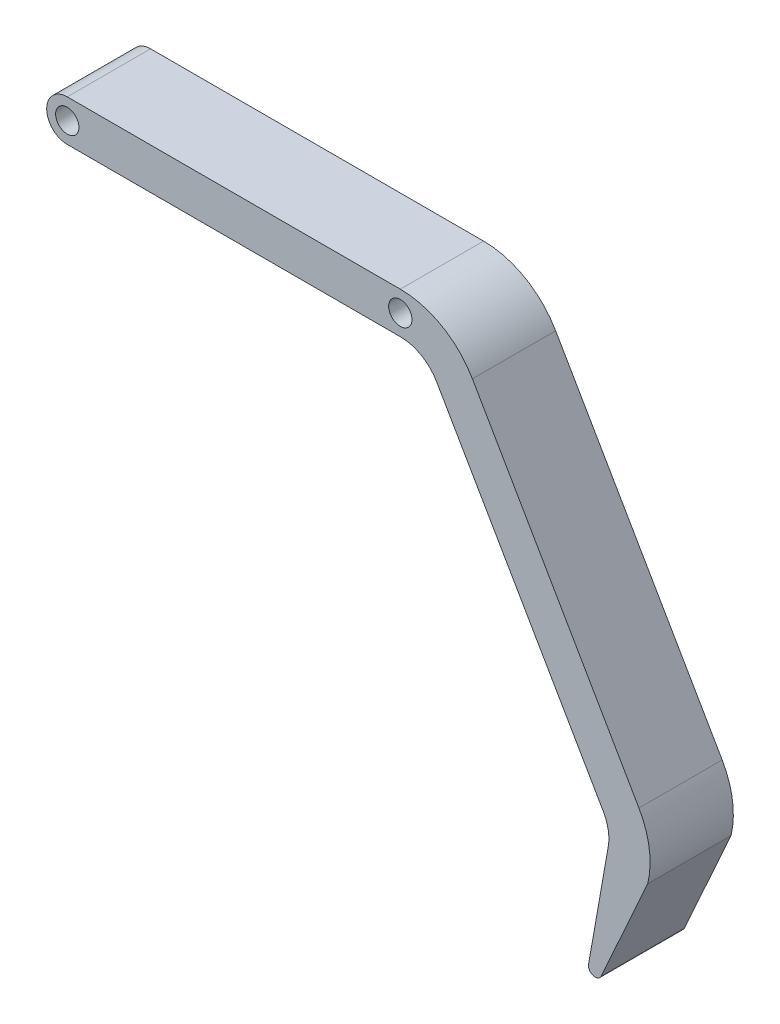
from build123d import *

# Parameters (mm, degrees)
BOSS_EXTRUDE1_DEPTH = 12.7
SKETCH2_R           = 1.778
CUT_EXTRUDE1_DEPTH  = 106.13339417
FILLET1_R           = 1.016


with BuildPart() as part:
    # Sketch1 → Boss-Extrude1 (new body)
    with BuildSketch(Plane.XY):
        with BuildLine():
            Line((-25.4, 0), (25.4, 0))
            ThreePointArc((25.4, 0), (31.75, -1.701477372), (36.398522628, -6.35))
            Line((36.398522628, -6.35), (61.798522628, -50.344090512))
            ThreePointArc((61.798522628, -50.344090512), (63.369186559, -54.875973564), (63.147095217, -59.6671764))
            Line((63.147095217, -59.6671764), (52.706203541, -82.822041569))
            Line((52.706203541, -82.822041569), (57.116867254, -57.807924643))
            ThreePointArc((57.116867254, -57.807924643), (57.116867254, -55.580256382), (56.354959836, -53.486932956))
            Line((56.354959836, -53.486932956), (30.954959836, -9.492842444))
            ThreePointArc((30.954959836, -9.492842444), (28.607157556, -7.145040164), (25.4, -6.285684887))
            Line((25.4, -6.285684887), (-25.4, -6.285684887))
            ThreePointArc((-25.4, -6.285684887), (-28.542842444, -3.142842444), (-25.4, 0))
        make_face()
    extrude(amount=BOSS_EXTRUDE1_DEPTH)

    # Sketch2 → Cut-Extrude1 (cut, through all)
    with BuildSketch(Plane.XY.offset(12.7)):
        with Locations((-25.4, -3.142842444)):
            Circle(SKETCH2_R)
    cut_extrude1 = extrude(amount=-CUT_EXTRUDE1_DEPTH, mode=Mode.SUBTRACT)

    # Mirror1: Cut-Extrude1 across plane
    add(cut_extrude1.mirror(Plane(origin=(0, 0, 0), x_dir=(0, 0, 1), z_dir=(1, 0, 0))), mode=Mode.SUBTRACT)

    # Fillet1
    fillet1_edges = [part.edges().sort_by_distance(p)[0] for p in [
        (52.706203541, -82.822041569, 6.35),
    ]]
    fillet(fillet1_edges, radius=FILLET1_R)


solid = part.part
